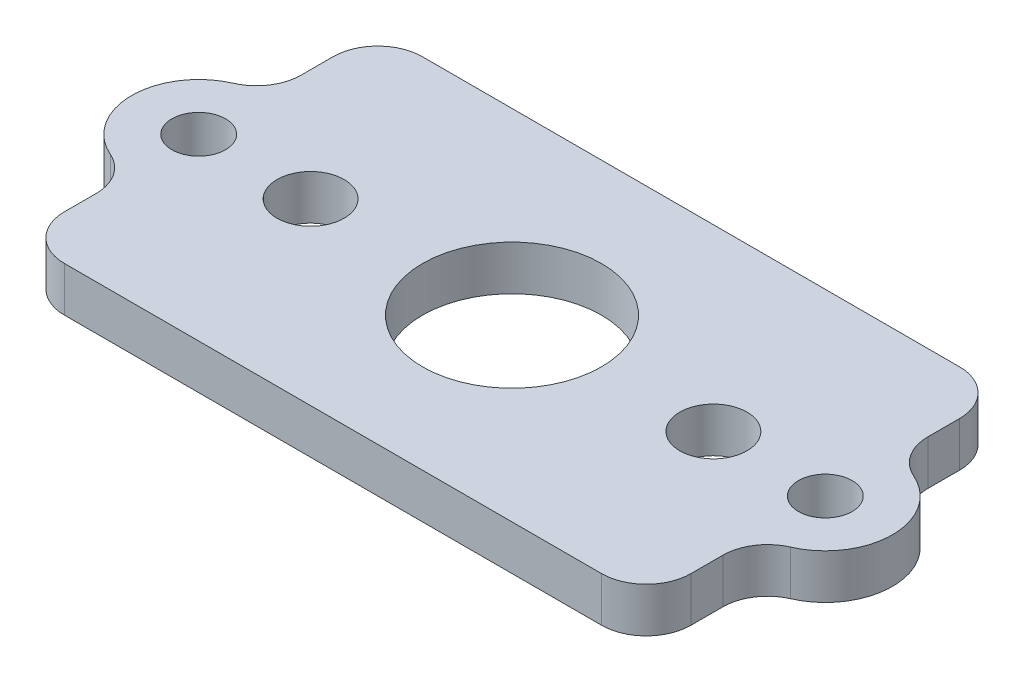
from build123d import *

# Parameters (mm, degrees)
EXTRUDE1_DEPTH      = 4
EXTRUDE2_DEPTH      = 12.357816692
EXTRUDE2_DEPTH_BACK = 12.357816692
SKETCH2_R           = 1
EXTRUDE3_DEPTH      = 12.357816692
EXTRUDE3_DEPTH_BACK = 12.357816692
SKETCH4_W           = 6
SKETCH4_H           = 8.732029078
FILLET2_R           = 1
EXTRUDE4_DEPTH      = 14
EXTRUDE4_DEPTH_BACK = 3
SKETCH3_R           = 1.5
EXTRUDE5_DEPTH      = 9
SKETCH6_R           = 1.5
EXTRUDE6_DEPTH      = 1
SKETCH7_R           = 0.6
EXTRUDE7_DEPTH      = 1
FILLET3_R           = 1
SKETCH8_R           = 2
EXTRUDE8_DEPTH      = 1
SKETCH9_R           = 15.158662045
EXTRUDE9_DEPTH      = 18.811513131
SKETCH_2_R          = 0.75
CUT_EXTRUDE_1_DEPTH = 10.447221814
FILLET_1_R          = 1


with BuildPart() as part:
    # Sketch1 → Extrude1 (new, symmetric)
    with BuildSketch(Plane.XY):
        Polygon((0, 0), (-7, 0), (-7, 8), (7, 8), (7, 0), align=None)
    extrude(amount=EXTRUDE1_DEPTH, both=True)

    # Sketch2 → Extrude2 (cut, two sides: drawn at the far end of the back side and taken through both)
    with BuildSketch(Plane.XY.offset(-EXTRUDE2_DEPTH_BACK)):
        with Locations((4.5, 5.5)):
            Circle(SKETCH2_R)
    extrude(amount=EXTRUDE2_DEPTH + EXTRUDE2_DEPTH_BACK, mode=Mode.SUBTRACT)

    # Sketch4 → Extrude3 (cut, two sides: drawn at the far end of the back side and taken through both)
    with BuildSketch(Plane(origin=(0, 0, 0), x_dir=(0, 0, -1), z_dir=(1, 0, 0)).offset(-EXTRUDE3_DEPTH_BACK)):
        with Locations((0, 5.366014539)):
            Rectangle(SKETCH4_W, SKETCH4_H)
    extrude(amount=EXTRUDE3_DEPTH + EXTRUDE3_DEPTH_BACK, mode=Mode.SUBTRACT)

    # Fillet2
    fillet2_edges = [part.edges().sort_by_distance(p)[0] for p in [
        (-7, 8, -3.5),
        (7, 8, -3.5),
        (-7, 8, 3.5),
        (7, 8, 3.5),
    ]]
    fillet(fillet2_edges, radius=FILLET2_R)

    # Sketch3 → Extrude4 (add, two sides: drawn at the far end of the back side and taken through both)
    with BuildSketch(Plane.XY.offset(-EXTRUDE4_DEPTH_BACK)):
        with Locations((-3, 4.5)):
            Circle(SKETCH3_R)
    extrude(amount=EXTRUDE4_DEPTH + EXTRUDE4_DEPTH_BACK)

    # Sketch5 → Extrude5 (cut)
    with BuildSketch(Plane.XY.offset(14)):
        Polygon((-4, 4.5), (-4, 6.060686456), (-4.95644391, 6.060686456), (-4.95644391, 2.5), (-4, 2.5), align=None)
    extrude(amount=-EXTRUDE5_DEPTH, mode=Mode.SUBTRACT)

    # Sketch6 → Extrude6 (add)
    with BuildSketch(Plane.XZ):
        with Locations((-7, 0)):
            Circle(SKETCH6_R)
        with Locations((7, 0)):
            Circle(SKETCH6_R)
    extrude(amount=-EXTRUDE6_DEPTH)

    # Sketch7 → Extrude7 (cut)
    with BuildSketch(Plane.XZ):
        with Locations((-7, 0)):
            Circle(SKETCH7_R)
        with Locations((7, 0)):
            Circle(SKETCH7_R)
    extrude(amount=-EXTRUDE7_DEPTH, mode=Mode.SUBTRACT)

    # Fillet3
    fillet3_edges = [part.edges().sort_by_distance(p)[0] for p in [
        (7, 0.5, -1.5),
        (7, 0.5, 1.5),
        (-7, 0.5, 1.5),
        (-7, 0.5, -1.5),
    ]]
    fillet(fillet3_edges, radius=FILLET3_R)

    # Sketch8 → Extrude8 (cut)
    with BuildSketch(Plane.XZ):
        Circle(SKETCH8_R)
    extrude(amount=-EXTRUDE8_DEPTH, mode=Mode.SUBTRACT)

    # Sketch9 → Extrude9 (cut, through all)
    with BuildSketch(Plane(origin=(0, 1, 0), x_dir=(1, 0, 0), z_dir=(0, 1, 0))):
        Circle(SKETCH9_R)
    extrude(amount=EXTRUDE9_DEPTH, mode=Mode.SUBTRACT)

    # Эскиз2 → Вырез-Вытянуть1 (cut, through all)
    with BuildSketch(Plane(origin=(0, 1, 0), x_dir=(1, 0, 0), z_dir=(0, 1, 0))):
        with Locations(Location((-4.5, 0, 0), (0, 0, 270))):
            Circle(SKETCH_2_R)
        with Locations(Location((4.5, 0, 0), (0, 0, 270))):
            Circle(SKETCH_2_R)
    extrude(amount=-CUT_EXTRUDE_1_DEPTH, mode=Mode.SUBTRACT)

    # Скругление1
    fillet_1_edges = [part.edges().sort_by_distance(p)[0] for p in [
        (-7, 0.5, -4),
        (-7, 0.5, 4),
        (7, 0.5, -4),
        (7, 0.5, 4),
    ]]
    fillet(fillet_1_edges, radius=FILLET_1_R)


solid = part.part
